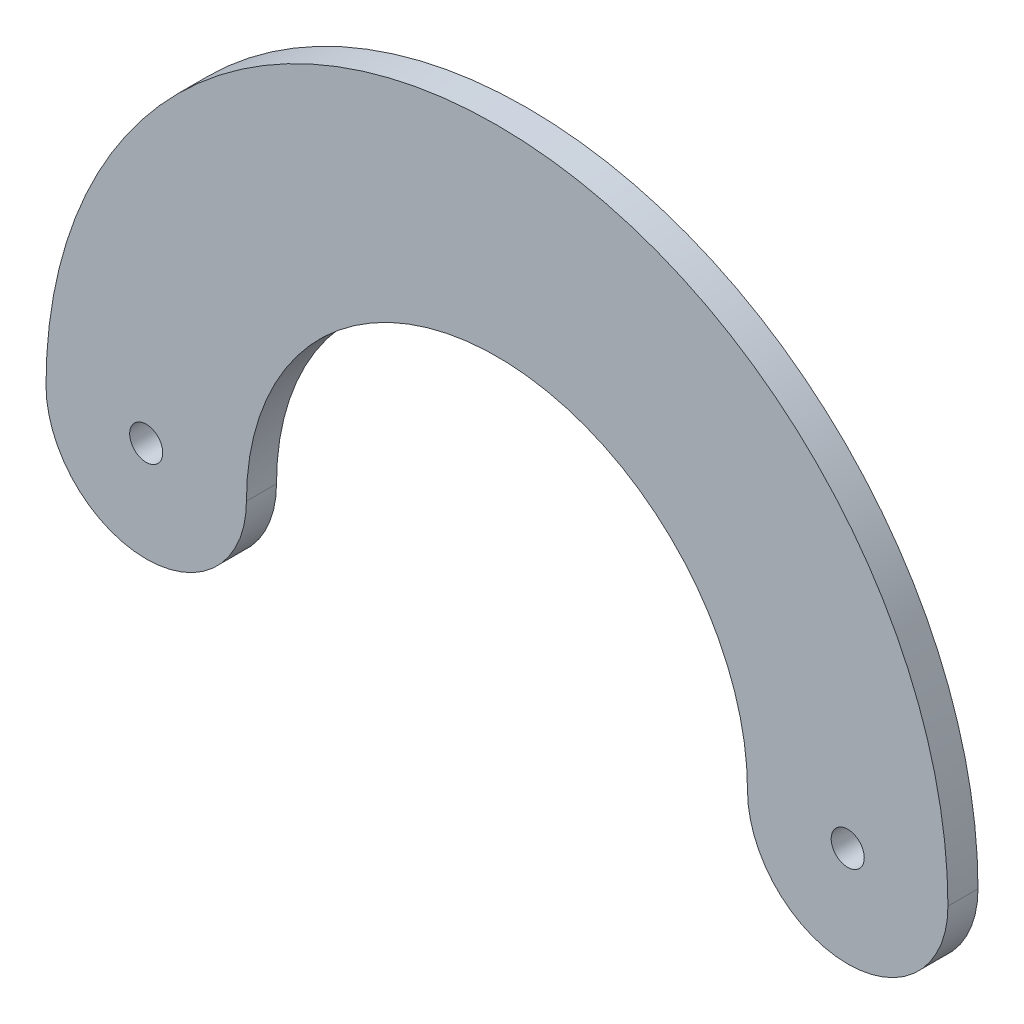
from build123d import *

# Parameters (mm, degrees)
SKETCH_1_R      = 1.65
EXTRUDE_1_DEPTH = 3


with BuildPart() as part:
    # 草图1 → 凸台-拉伸1 (new body)
    with BuildSketch(Plane.XY):
        with BuildLine():
            ThreePointArc((-25, 0), (0, 25), (25, 0))
            ThreePointArc((25, 0), (35, -10), (45, 0))
            ThreePointArc((45, 0), (0, 45), (-45, 0))
            ThreePointArc((-45, 0), (-35, -10), (-25, 0))
        make_face()
        with Locations((-35, 0)):
            Circle(SKETCH_1_R, mode=Mode.SUBTRACT)
        with Locations((35, 0)):
            Circle(SKETCH_1_R, mode=Mode.SUBTRACT)
    extrude(amount=EXTRUDE_1_DEPTH)


solid = part.part
